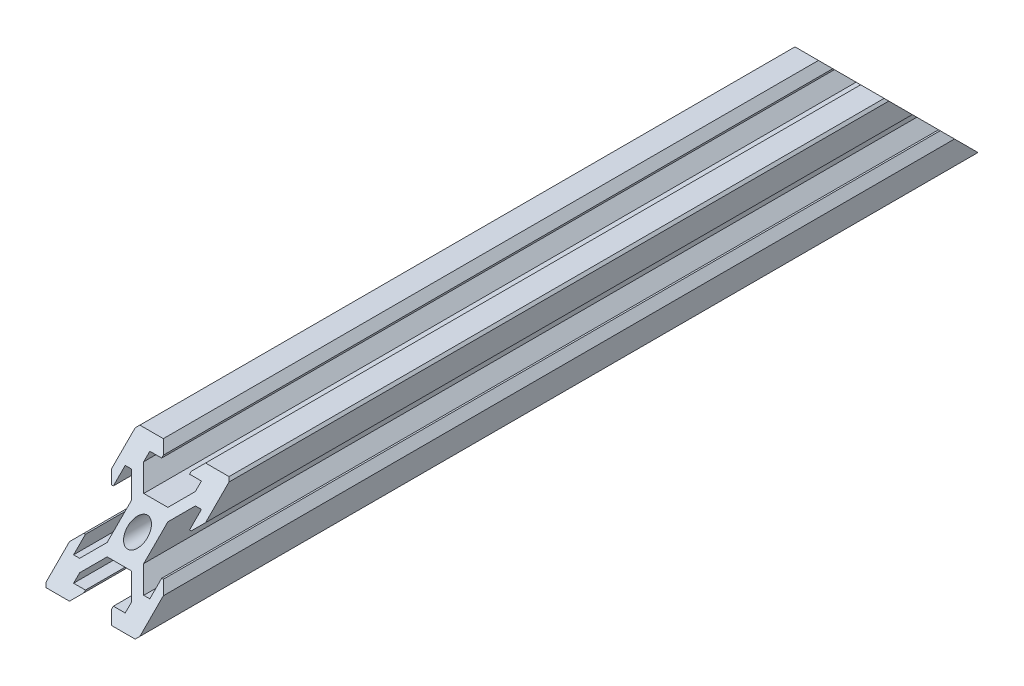
from build123d import *

# Parameters (mm, degrees)
BOSS_EXTRUDE1_DEPTH = 179.605122421
CHAMFER2_SIZE       = 0.5
CHAMFER2_SIZE2      = 0.353553391
CHAMFER1_SIZE       = 0.5
CUT_EXTRUDE1_REACH  = 182.992


with BuildPart() as part:
    # Sketch1 → Boss-Extrude1 (new body)
    with BuildSketch(Plane.XY):
        with BuildLine():
            Line((5.5, 6.829360749), (2.570639251, 3.9))
            Line((2.570639251, 3.9), (0, 3.9))
            Line((0, 3.9), (0, 2.1))
            ThreePointArc((0, 2.1), (0.803635208, 1.940147018), (1.48492424, 1.48492424))
            Line((1.48492424, 1.48492424), (10, 10))
            Line((10, 10), (4.5, 10))
            Line((4.5, 10), (2.62, 8.12))
            Line((2.62, 8.12), (5.5, 8.12))
            Line((5.5, 8.12), (5.5, 6.829360749))
        make_face()
    extrude(amount=BOSS_EXTRUDE1_DEPTH)

    # Chamfer2
    chamfer2_edges = [part.edges().sort_by_distance(p)[0] for p in [
        (2.62, 8.12, 89.802561211),
    ]]
    chamfer2_side = [part.faces().sort_by_distance(p)[0] for p in [
        (3.56, 9.06, 89.802561211),
    ]]
    chamfer(chamfer2_edges, length=CHAMFER2_SIZE, length2=CHAMFER2_SIZE2, reference=chamfer2_side[0])

    # Mirror1: part across plane


with BuildPart() as part_1:
    add(part.part)
    add(part.part.mirror(Plane(origin=(10, 10, 179.605122421), x_dir=(0, 0, 1), z_dir=(-0.707106781186544, 0.7071067811865511, 0))))

    # Chamfer1
    chamfer1_edges = [part_1.edges().sort_by_distance(p)[0] for p in [
        (10, 10, 89.802561211),
    ]]
    chamfer(chamfer1_edges, length=CHAMFER1_SIZE)

    # Mirror4: part across plane


with BuildPart() as part_2:
    add(part_1.part)
    add(part_1.part.mirror(Plane(origin=(0, 3.9, 179.605122421), x_dir=(0, 0, 1), z_dir=(1, 0, 0))))

    # Mirror5: part across plane


with BuildPart() as part_3:
    add(part_2.part)
    add(part_2.part.mirror(Plane(origin=(-3.9, 0, 179.605122421), x_dir=(0, 0, 1), z_dir=(0, 1, 0))))

    # Cut-Extrude1: up to this face of the body (flat: up to its plane)
    cut_extrude1_end = Plane(part_3.part.faces().sort_by_distance((-10, 7, 89.802561211))[0])
    # Sketch2 → Cut-Extrude1 (cut, up to the picked face)
    with BuildSketch(Plane(origin=(10, 0, 0), x_dir=(0, 0, -1), z_dir=(1, 0, 0)), mode=Mode.PRIVATE) as cut_extrude1_sk1:
        Polygon((0, -10), (-20, 10), (0, 10), align=None)
    cut_extrude1_tool1 = split(extrude(cut_extrude1_sk1.sketch, amount=-CUT_EXTRUDE1_REACH, mode=Mode.PRIVATE), bisect_by=cut_extrude1_end, keep=Keep.BOTH, mode=Mode.PRIVATE)
    # Sketch2 → Cut-Extrude1 (cut, up to the picked face)
    with BuildSketch(Plane(origin=(10, 0, 0), x_dir=(0, 0, -1), z_dir=(1, 0, 0)), mode=Mode.PRIVATE) as cut_extrude1_sk2:
        Polygon((-159.605122421, 10), (-179.605122421, 10), (-179.605122421, -10), align=None)
    cut_extrude1_tool2 = split(extrude(cut_extrude1_sk2.sketch, amount=-CUT_EXTRUDE1_REACH, mode=Mode.PRIVATE), bisect_by=cut_extrude1_end, keep=Keep.BOTH, mode=Mode.PRIVATE)
    add(cut_extrude1_tool1.solids().sort_by(Axis((10, 3.333333, 6.666667), (-1, 0, 0)))[0], mode=Mode.SUBTRACT)
    add(cut_extrude1_tool2.solids().sort_by(Axis((10, 3.333333, 172.938456), (-1, 0, 0)))[0], mode=Mode.SUBTRACT)


solid = part_3.part
